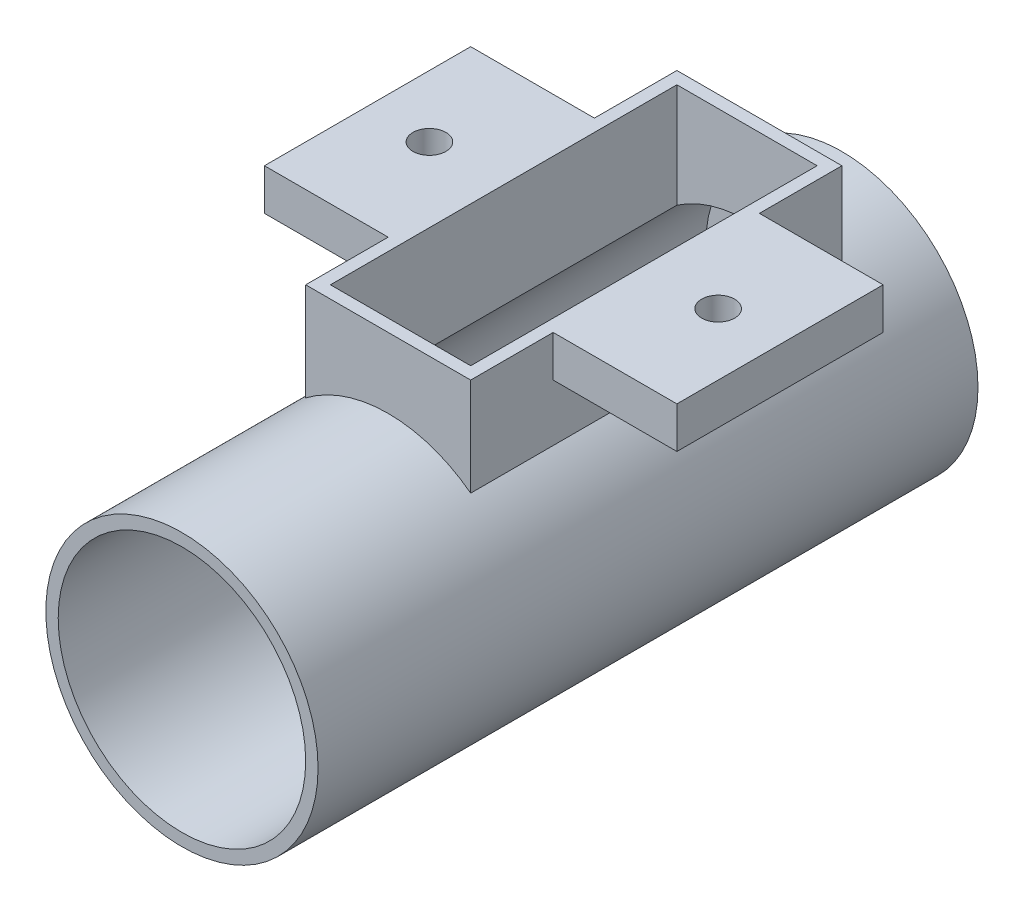
from build123d import *

# Parameters (mm, degrees)
SKETCH_1_R           = 33
EXTRUDE_1_DEPTH      = 160
SHELL_1_T            = -3
EXTRUDE_2_REACH      = 185.243
EXTRUDE_2_END_RADIUS = 33
SKETCH_2_W           = 40
SKETCH_2_H           = 90
SKETCH_3_W           = 34
SKETCH_3_H           = 84
CUT_EXTRUDE_1_DEPTH  = 60
SKETCH_4_W           = 50
SKETCH_4_H           = 10
EXTRUDE_3_DEPTH      = 30
SKETCH_5_R           = 4
CUT_EXTRUDE_2_DEPTH  = 30
SKETCH_6_W           = 50
SKETCH_6_H           = 10
EXTRUDE_4_DEPTH      = 30
SKETCH_7_R           = 4
CUT_EXTRUDE_3_DEPTH  = 30
SKETCH_8_R           = 3.75
CUT_EXTRUDE_4_DEPTH  = 10


with BuildPart() as part:
    # 草图1 → 凸台-拉伸1 (new body)
    with BuildSketch(Plane.XY):
        Circle(SKETCH_1_R)
    extrude(amount=EXTRUDE_1_DEPTH)

    # 抽壳1
    shell_1_openings = [part.faces().sort_by_distance(p)[0] for p in [
        (0, 0, 160),
    ]]
    offset(amount=SHELL_1_T, openings=shell_1_openings, kind=Kind.INTERSECTION)

    # 凸台-拉伸2: up to this cylinder (the profile starts outside it)
    extrude_2_end = Plane(origin=(0, 0, 65), z_dir=(0, 0, -1)) * Cylinder(EXTRUDE_2_END_RADIUS, 437.486, mode=Mode.PRIVATE)
    # 草图2 → 凸台-拉伸2 (add, up to the surface)
    with BuildSketch(Plane(origin=(0, 50, 0), x_dir=(1, 0, 0), z_dir=(0, 1, 0)), mode=Mode.PRIVATE) as extrude_2_sk1:
        with Locations((0, -65)):
            Rectangle(SKETCH_2_W, SKETCH_2_H)
    extrude_2_tool1 = extrude(extrude_2_sk1.sketch, amount=-EXTRUDE_2_REACH, mode=Mode.PRIVATE) - extrude_2_end
    add(extrude_2_tool1.solids().sort_by_distance((0, 50, 65))[0])

    # 草图3 → 切除-拉伸1 (cut)
    with BuildSketch(Plane(origin=(0, 50, 0), x_dir=(1, 0, 0), z_dir=(0, 1, 0))):
        with Locations((0, -65)):
            Rectangle(SKETCH_3_W, SKETCH_3_H)
    extrude(amount=-CUT_EXTRUDE_1_DEPTH, mode=Mode.SUBTRACT)

    # 草图4 → 凸台-拉伸3 (add)
    with BuildSketch(Plane.ZY.offset(20)):
        with Locations((65, 45)):
            Rectangle(SKETCH_4_W, SKETCH_4_H)
    extrude(amount=EXTRUDE_3_DEPTH)

    # 草图5 → 切除-拉伸2 (cut)
    with BuildSketch(Plane(origin=(0, 50, 0), x_dir=(1, 0, 0), z_dir=(0, 1, 0))):
        with Locations(Location((-35, -65, 0), (0, 0, 270))):
            Circle(SKETCH_5_R)
    extrude(amount=-CUT_EXTRUDE_2_DEPTH, mode=Mode.SUBTRACT)

    # 草图6 → 凸台-拉伸4 (add)
    with BuildSketch(Plane(origin=(20, 0, 0), x_dir=(0, 0, -1), z_dir=(1, 0, 0))):
        with Locations((-65, 45)):
            Rectangle(SKETCH_6_W, SKETCH_6_H)
    extrude(amount=EXTRUDE_4_DEPTH)

    # 草图7 → 切除-拉伸3 (cut)
    with BuildSketch(Plane(origin=(0, 50, 0), x_dir=(1, 0, 0), z_dir=(0, 1, 0))):
        with Locations(Location((35, -65, 0), (0, 0, 270))):
            Circle(SKETCH_7_R)
    extrude(amount=-CUT_EXTRUDE_3_DEPTH, mode=Mode.SUBTRACT)

    # 草图8 → 切除-拉伸4 (cut)
    with BuildSketch(Plane(origin=(0, 0, 0), x_dir=(-1, 0, 0), z_dir=(0, 0, -1))):
        Circle(SKETCH_8_R)
    extrude(amount=-CUT_EXTRUDE_4_DEPTH, mode=Mode.SUBTRACT)


solid = part.part
